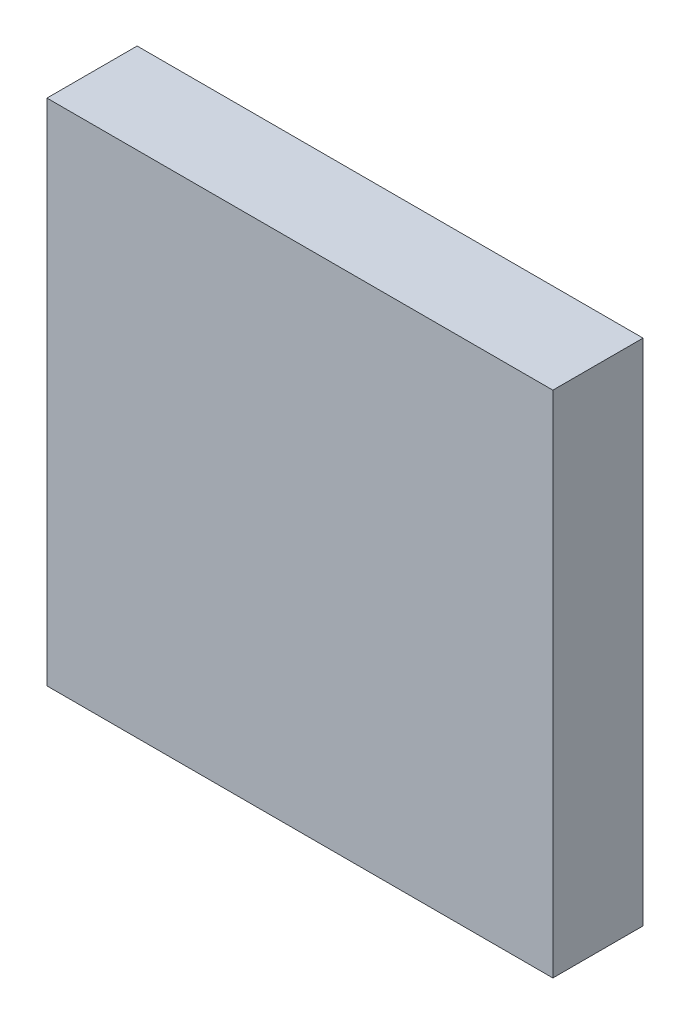
from build123d import *

# Parameters (mm, degrees)
SKETCH1_W           = 56.103669693
SKETCH1_H           = 56.45875621
BOSS_EXTRUDE1_DEPTH = 10


with BuildPart() as part:
    # Sketch1 → Boss-Extrude1 (new body)
    with BuildSketch(Plane.XY):
        with Locations((28.051834847, 28.229378105)):
            Rectangle(SKETCH1_W, SKETCH1_H)
    extrude(amount=BOSS_EXTRUDE1_DEPTH)


solid = part.part
